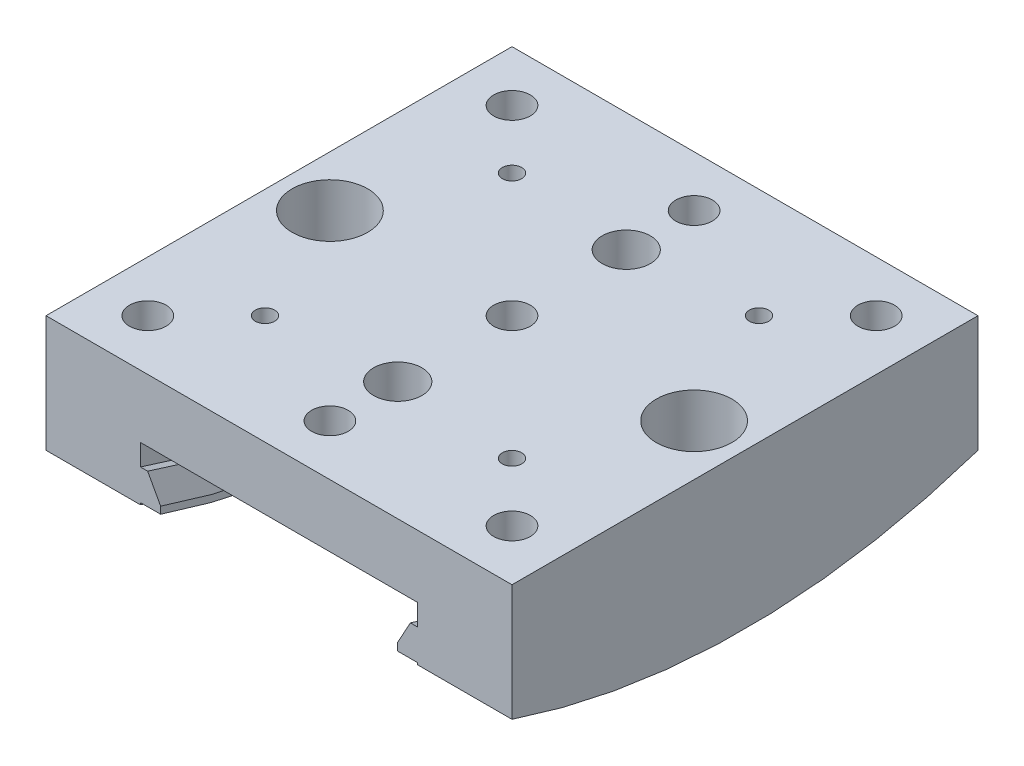
from build123d import *

# Parameters (mm, degrees)
SKIZZE1_W                            = 65
SKIZZE1_H                            = 30
AUFSATZ_LINEAR_AUSTRAGEN1_DEPTH      = 65
SCHNITT_LINEAR_AUSTRAGEN2_DEPTH      = 94.139680207
SCHNITT_LINEAR_AUSTRAGEN2_DEPTH_BACK = 94.139680207
SCHNITT_LINEAR_AUSTRAGEN4_REACH      = 77.814
SKIZZE10_R                           = 5.2705
SKIZZE10_R_2                         = 3.3655
SKIZZE10_R_3                         = 2.5525
SKIZZE10_R_4                         = 1.3525


with BuildPart() as part:
    # Skizze1 → Aufsatz-Linear austragen1 (new body)
    with BuildSketch(Plane.XY):
        Rectangle(SKIZZE1_W, SKIZZE1_H)
    extrude(amount=AUFSATZ_LINEAR_AUSTRAGEN1_DEPTH)

    # Schnitt-Austragung2: sweep along a path in Skizze8
    with BuildLine(Plane(origin=(0, 0, 0), x_dir=(0, 0, -1), z_dir=(1, 0, 0))) as schnitt_austragung2_path:
        CenterArc((-32.5, 95), 101.346, 0, 360)
    # Skizze7 → Schnitt-Austragung2 (sweep, cut)
    with BuildSketch(Plane.XY.offset(65)):
        Polygon((19.3305, 6.277), (-19.3305, 6.277), (-19.3305, 3.307), (-18.3215, 3.307), (-16.5095, -0.015), (-16.5095, -0.994), (-19.3305, -0.994), (-19.3305, -1.262), (19.3305, -1.262), (19.3305, -0.994), (16.5095, -0.994), (16.5095, -0.015), (18.3215, 3.307), (19.3305, 3.307), align=None)
    sweep(path=schnitt_austragung2_path.line, mode=Mode.SUBTRACT)

    # Skizze9 → Schnitt-Linear austragen2 (cut, two sides: drawn at the far end of the back side and taken through both)
    with BuildSketch(Plane.ZY.offset(32.5).offset(-SCHNITT_LINEAR_AUSTRAGEN2_DEPTH_BACK)):
        with BuildLine():
            ThreePointArc((65, -1.261674617), (32.5, -6.6), (0, -1.261674617))
            Line((0, -1.261674617), (0, -15))
            Line((0, -15), (65, -15))
            Line((65, -15), (65, -1.261674617))
        make_face()
    extrude(amount=SCHNITT_LINEAR_AUSTRAGEN2_DEPTH + SCHNITT_LINEAR_AUSTRAGEN2_DEPTH_BACK, mode=Mode.SUBTRACT)

    # Skizze10 → Schnitt-Linear austragen4 (cut, up to next)
    with BuildSketch(Plane(origin=(0, 15, 0), x_dir=(1, 0, 0), z_dir=(0, 1, 0)), mode=Mode.PRIVATE) as schnitt_linear_austragen4_sk1:
        with Locations(Location((-25.399, -32.5, 0), (0, 0, 270))):
            Circle(SKIZZE10_R)
    schnitt_linear_austragen4_tool1 = extrude(schnitt_linear_austragen4_sk1.sketch, amount=-SCHNITT_LINEAR_AUSTRAGEN4_REACH, mode=Mode.PRIVATE) & part.part
    # Skizze10 → Schnitt-Linear austragen4 (cut, up to next)
    with BuildSketch(Plane(origin=(0, 15, 0), x_dir=(1, 0, 0), z_dir=(0, 1, 0)), mode=Mode.PRIVATE) as schnitt_linear_austragen4_sk2:
        with Locations(Location((25.399, -32.5, 0), (0, 0, 270))):
            Circle(SKIZZE10_R)
    schnitt_linear_austragen4_tool2 = extrude(schnitt_linear_austragen4_sk2.sketch, amount=-SCHNITT_LINEAR_AUSTRAGEN4_REACH, mode=Mode.PRIVATE) & part.part
    # Skizze10 → Schnitt-Linear austragen4 (cut, up to next)
    with BuildSketch(Plane(origin=(0, 15, 0), x_dir=(1, 0, 0), z_dir=(0, 1, 0)), mode=Mode.PRIVATE) as schnitt_linear_austragen4_sk3:
        with Locations(Location((0, -16.562, 0), (0, 0, 270))):
            Circle(SKIZZE10_R_2)
    schnitt_linear_austragen4_tool3 = extrude(schnitt_linear_austragen4_sk3.sketch, amount=-SCHNITT_LINEAR_AUSTRAGEN4_REACH, mode=Mode.PRIVATE) & part.part
    # Skizze10 → Schnitt-Linear austragen4 (cut, up to next)
    with BuildSketch(Plane(origin=(0, 15, 0), x_dir=(1, 0, 0), z_dir=(0, 1, 0)), mode=Mode.PRIVATE) as schnitt_linear_austragen4_sk4:
        with Locations(Location((0, -48.438, 0), (0, 0, 270))):
            Circle(SKIZZE10_R_2)
    schnitt_linear_austragen4_tool4 = extrude(schnitt_linear_austragen4_sk4.sketch, amount=-SCHNITT_LINEAR_AUSTRAGEN4_REACH, mode=Mode.PRIVATE) & part.part
    # Skizze10 → Schnitt-Linear austragen4 (cut, up to next)
    with BuildSketch(Plane(origin=(0, 15, 0), x_dir=(1, 0, 0), z_dir=(0, 1, 0)), mode=Mode.PRIVATE) as schnitt_linear_austragen4_sk5:
        with Locations(Location((-25.4, -7.1, 0), (0, 0, 270))):
            Circle(SKIZZE10_R_3)
    schnitt_linear_austragen4_tool5 = extrude(schnitt_linear_austragen4_sk5.sketch, amount=-SCHNITT_LINEAR_AUSTRAGEN4_REACH, mode=Mode.PRIVATE) & part.part
    # Skizze10 → Schnitt-Linear austragen4 (cut, up to next)
    with BuildSketch(Plane(origin=(0, 15, 0), x_dir=(1, 0, 0), z_dir=(0, 1, 0)), mode=Mode.PRIVATE) as schnitt_linear_austragen4_sk6:
        with Locations(Location((25.4, -7.1, 0), (0, 0, 270))):
            Circle(SKIZZE10_R_3)
    schnitt_linear_austragen4_tool6 = extrude(schnitt_linear_austragen4_sk6.sketch, amount=-SCHNITT_LINEAR_AUSTRAGEN4_REACH, mode=Mode.PRIVATE) & part.part
    # Skizze10 → Schnitt-Linear austragen4 (cut, up to next)
    with BuildSketch(Plane(origin=(0, 15, 0), x_dir=(1, 0, 0), z_dir=(0, 1, 0)), mode=Mode.PRIVATE) as schnitt_linear_austragen4_sk7:
        with Locations(Location((0, -7.1, 0), (0, 0, 270))):
            Circle(SKIZZE10_R_3)
    schnitt_linear_austragen4_tool7 = extrude(schnitt_linear_austragen4_sk7.sketch, amount=-SCHNITT_LINEAR_AUSTRAGEN4_REACH, mode=Mode.PRIVATE) & part.part
    # Skizze10 → Schnitt-Linear austragen4 (cut, up to next)
    with BuildSketch(Plane(origin=(0, 15, 0), x_dir=(1, 0, 0), z_dir=(0, 1, 0)), mode=Mode.PRIVATE) as schnitt_linear_austragen4_sk8:
        with Locations(Location((25.4, -57.9, 0), (0, 0, 270))):
            Circle(SKIZZE10_R_3)
    schnitt_linear_austragen4_tool8 = extrude(schnitt_linear_austragen4_sk8.sketch, amount=-SCHNITT_LINEAR_AUSTRAGEN4_REACH, mode=Mode.PRIVATE) & part.part
    # Skizze10 → Schnitt-Linear austragen4 (cut, up to next)
    with BuildSketch(Plane(origin=(0, 15, 0), x_dir=(1, 0, 0), z_dir=(0, 1, 0)), mode=Mode.PRIVATE) as schnitt_linear_austragen4_sk9:
        with Locations(Location((0, -57.9, 0), (0, 0, 270))):
            Circle(SKIZZE10_R_3)
    schnitt_linear_austragen4_tool9 = extrude(schnitt_linear_austragen4_sk9.sketch, amount=-SCHNITT_LINEAR_AUSTRAGEN4_REACH, mode=Mode.PRIVATE) & part.part
    # Skizze10 → Schnitt-Linear austragen4 (cut, up to next)
    with BuildSketch(Plane(origin=(0, 15, 0), x_dir=(1, 0, 0), z_dir=(0, 1, 0)), mode=Mode.PRIVATE) as schnitt_linear_austragen4_sk10:
        with Locations(Location((-25.4, -57.9, 0), (0, 0, 270))):
            Circle(SKIZZE10_R_3)
    schnitt_linear_austragen4_tool10 = extrude(schnitt_linear_austragen4_sk10.sketch, amount=-SCHNITT_LINEAR_AUSTRAGEN4_REACH, mode=Mode.PRIVATE) & part.part
    # Skizze10 → Schnitt-Linear austragen4 (cut, up to next)
    with BuildSketch(Plane(origin=(0, 15, 0), x_dir=(1, 0, 0), z_dir=(0, 1, 0)), mode=Mode.PRIVATE) as schnitt_linear_austragen4_sk11:
        with Locations(Location((-17.227, -15.273, 0), (0, 0, 270))):
            Circle(SKIZZE10_R_4)
    schnitt_linear_austragen4_tool11 = extrude(schnitt_linear_austragen4_sk11.sketch, amount=-SCHNITT_LINEAR_AUSTRAGEN4_REACH, mode=Mode.PRIVATE) & part.part
    # Skizze10 → Schnitt-Linear austragen4 (cut, up to next)
    with BuildSketch(Plane(origin=(0, 15, 0), x_dir=(1, 0, 0), z_dir=(0, 1, 0)), mode=Mode.PRIVATE) as schnitt_linear_austragen4_sk12:
        with Locations(Location((17.227, -15.273, 0), (0, 0, 270))):
            Circle(SKIZZE10_R_4)
    schnitt_linear_austragen4_tool12 = extrude(schnitt_linear_austragen4_sk12.sketch, amount=-SCHNITT_LINEAR_AUSTRAGEN4_REACH, mode=Mode.PRIVATE) & part.part
    # Skizze10 → Schnitt-Linear austragen4 (cut, up to next)
    with BuildSketch(Plane(origin=(0, 15, 0), x_dir=(1, 0, 0), z_dir=(0, 1, 0)), mode=Mode.PRIVATE) as schnitt_linear_austragen4_sk13:
        with Locations(Location((17.227, -49.727, 0), (0, 0, 270))):
            Circle(SKIZZE10_R_4)
    schnitt_linear_austragen4_tool13 = extrude(schnitt_linear_austragen4_sk13.sketch, amount=-SCHNITT_LINEAR_AUSTRAGEN4_REACH, mode=Mode.PRIVATE) & part.part
    # Skizze10 → Schnitt-Linear austragen4 (cut, up to next)
    with BuildSketch(Plane(origin=(0, 15, 0), x_dir=(1, 0, 0), z_dir=(0, 1, 0)), mode=Mode.PRIVATE) as schnitt_linear_austragen4_sk14:
        with Locations(Location((-17.227, -49.727, 0), (0, 0, 270))):
            Circle(SKIZZE10_R_4)
    schnitt_linear_austragen4_tool14 = extrude(schnitt_linear_austragen4_sk14.sketch, amount=-SCHNITT_LINEAR_AUSTRAGEN4_REACH, mode=Mode.PRIVATE) & part.part
    # Skizze10 → Schnitt-Linear austragen4 (cut, up to next)
    with BuildSketch(Plane(origin=(0, 15, 0), x_dir=(1, 0, 0), z_dir=(0, 1, 0)), mode=Mode.PRIVATE) as schnitt_linear_austragen4_sk15:
        with Locations(Location((0, -32.5, 0), (0, 0, 270))):
            Circle(SKIZZE10_R_3)
    schnitt_linear_austragen4_tool15 = extrude(schnitt_linear_austragen4_sk15.sketch, amount=-SCHNITT_LINEAR_AUSTRAGEN4_REACH, mode=Mode.PRIVATE) & part.part
    add(schnitt_linear_austragen4_tool1.solids().sort_by_distance((-25.399, 15, 32.5))[0], mode=Mode.SUBTRACT)
    add(schnitt_linear_austragen4_tool2.solids().sort_by_distance((25.399, 15, 32.5))[0], mode=Mode.SUBTRACT)
    add(schnitt_linear_austragen4_tool3.solids().sort_by_distance((0, 15, 16.562))[0], mode=Mode.SUBTRACT)
    add(schnitt_linear_austragen4_tool4.solids().sort_by_distance((0, 15, 48.438))[0], mode=Mode.SUBTRACT)
    add(schnitt_linear_austragen4_tool5.solids().sort_by_distance((-25.4, 15, 7.1))[0], mode=Mode.SUBTRACT)
    add(schnitt_linear_austragen4_tool6.solids().sort_by_distance((25.4, 15, 7.1))[0], mode=Mode.SUBTRACT)
    add(schnitt_linear_austragen4_tool7.solids().sort_by_distance((0, 15, 7.1))[0], mode=Mode.SUBTRACT)
    add(schnitt_linear_austragen4_tool8.solids().sort_by_distance((25.4, 15, 57.9))[0], mode=Mode.SUBTRACT)
    add(schnitt_linear_austragen4_tool9.solids().sort_by_distance((0, 15, 57.9))[0], mode=Mode.SUBTRACT)
    add(schnitt_linear_austragen4_tool10.solids().sort_by_distance((-25.4, 15, 57.9))[0], mode=Mode.SUBTRACT)
    add(schnitt_linear_austragen4_tool11.solids().sort_by_distance((-17.227, 15, 15.273))[0], mode=Mode.SUBTRACT)
    add(schnitt_linear_austragen4_tool12.solids().sort_by_distance((17.227, 15, 15.273))[0], mode=Mode.SUBTRACT)
    add(schnitt_linear_austragen4_tool13.solids().sort_by_distance((17.227, 15, 49.727))[0], mode=Mode.SUBTRACT)
    add(schnitt_linear_austragen4_tool14.solids().sort_by_distance((-17.227, 15, 49.727))[0], mode=Mode.SUBTRACT)
    add(schnitt_linear_austragen4_tool15.solids().sort_by_distance((0, 15, 32.5))[0], mode=Mode.SUBTRACT)


solid = part.part
